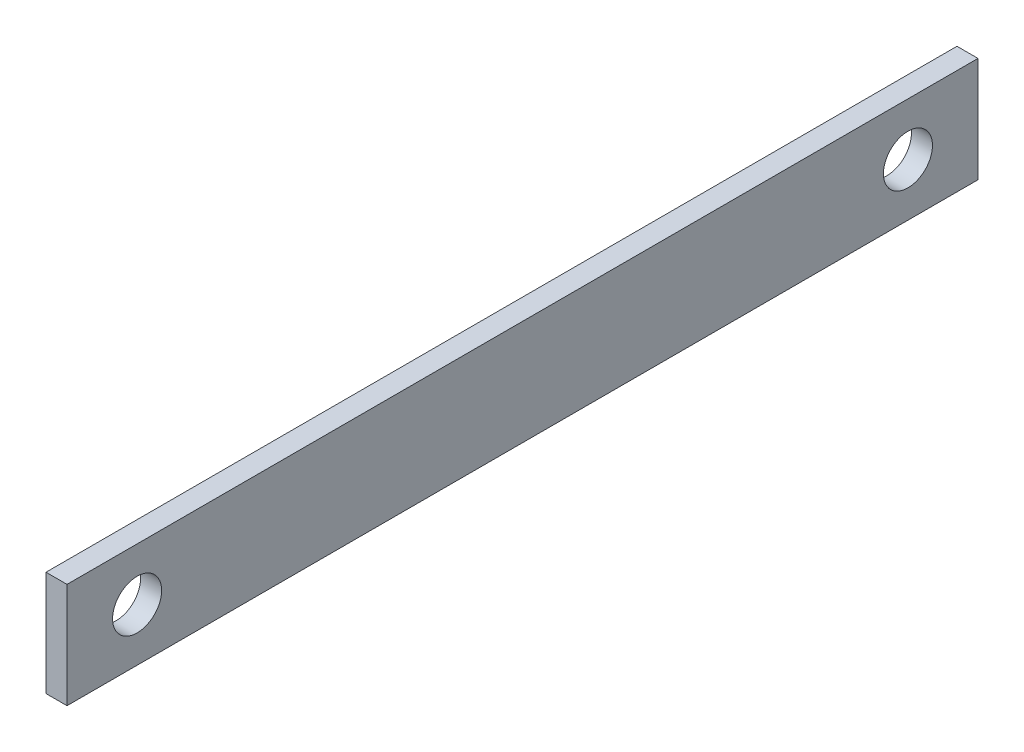
from build123d import *

# Parameters (mm, degrees)
SKETCH1_W           = 260
SKETCH1_H           = 30
SKETCH1_R           = 7
BOSS_EXTRUDE1_DEPTH = 6


with BuildPart() as part:
    # Sketch1 → Boss-Extrude1 (new body)
    with BuildSketch(Plane(origin=(0, 0, 0), x_dir=(0, 0, -1), z_dir=(1, 0, 0))):
        Rectangle(SKETCH1_W, SKETCH1_H)
        with Locations((-110, 0)):
            Circle(SKETCH1_R, mode=Mode.SUBTRACT)
        with Locations((110, 0)):
            Circle(SKETCH1_R, mode=Mode.SUBTRACT)
    extrude(amount=BOSS_EXTRUDE1_DEPTH)


solid = part.part
